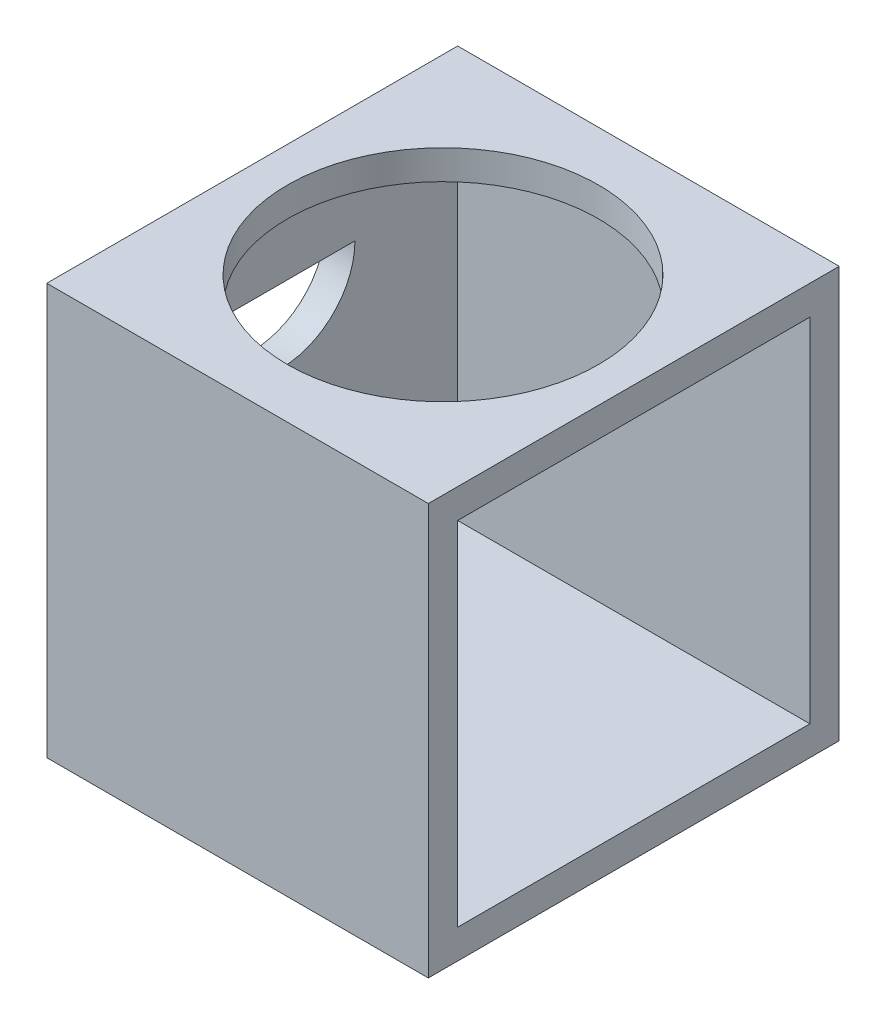
from build123d import *

# Parameters (mm, degrees)
SKETCH2_W           = 140
SKETCH2_H           = 140
SKETCH2_W_2         = 120
SKETCH2_H_2         = 120
EXTRUDE_THIN1_DEPTH = 120
SKETCH3_W           = 140
SKETCH3_H           = 140
BOSS_EXTRUDE1_DEPTH = 10
CUT_EXTRUDE1_REACH  = 199.231
SKETCH5_R           = 53
CUT_EXTRUDE4_REACH  = 165.401


with BuildPart() as part:
    # Sketch2 → Extrude-Thin1 (new body)
    with BuildSketch(Plane(origin=(0, 0, 0), x_dir=(0, 0, -1), z_dir=(1, 0, 0))):
        Rectangle(SKETCH2_W, SKETCH2_H)
        Rectangle(SKETCH2_W_2, SKETCH2_H_2, mode=Mode.SUBTRACT)
    extrude(amount=EXTRUDE_THIN1_DEPTH)

    # Sketch3 → Boss-Extrude1 (add)
    with BuildSketch(Plane.ZY):
        Rectangle(SKETCH3_W, SKETCH3_H)
    extrude(amount=BOSS_EXTRUDE1_DEPTH)

    # Sketch5 → Cut-Extrude1 (cut, up to next)
    with BuildSketch(Plane(origin=(0, 70, 0), x_dir=(1, 0, 0), z_dir=(0, 1, 0)), mode=Mode.PRIVATE) as cut_extrude1_sk1:
        with Locations(Location((55, 0, 0), (0, 0, 270))):
            Circle(SKETCH5_R)
    cut_extrude1_tool1 = extrude(cut_extrude1_sk1.sketch, amount=-CUT_EXTRUDE1_REACH, mode=Mode.PRIVATE) & part.part
    add(cut_extrude1_tool1.solids().sort_by_distance((55, 70, 0))[0], mode=Mode.SUBTRACT)

    # Sketch8 → Cut-Extrude4 (cut, up to next)
    with BuildSketch(Plane.ZY.offset(10), mode=Mode.PRIVATE) as cut_extrude4_sk1:
        with BuildLine():
            Line((-25, 40), (25, 40))
            ThreePointArc((25, 40), (0, 15), (-25, 40))
        make_face()
    cut_extrude4_tool1 = extrude(cut_extrude4_sk1.sketch, amount=-CUT_EXTRUDE4_REACH, mode=Mode.PRIVATE) & part.part
    add(cut_extrude4_tool1.solids().sort_by_distance((-10, 29.38967, 0))[0], mode=Mode.SUBTRACT)


solid = part.part
